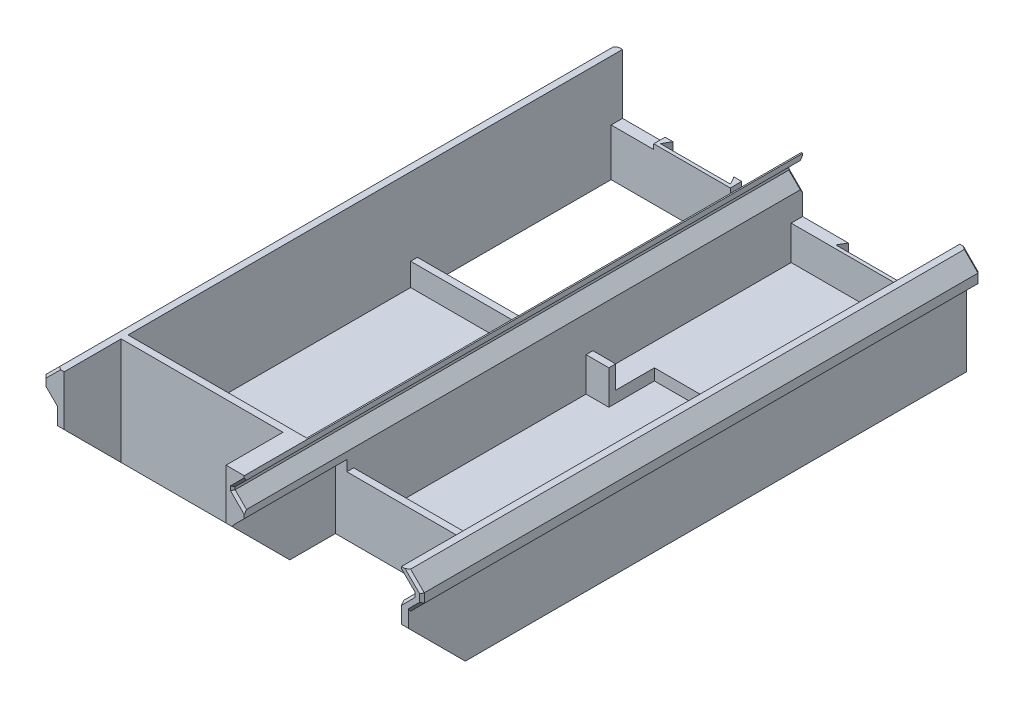
from build123d import *

# Parameters (mm, degrees)
EXTRUDE_1_DEPTH       = 200
SKETCH_3_W            = 148
SKETCH_3_H            = 194
CUT_EXTRUDE_1_DEPTH   = 44
SKETCH_4_W            = 8
SKETCH_4_H            = 194
EXTRUDE_1_2_DEPTH     = 44
CUT_EXTRUDE_2_DEPTH   = 222.580685079
CUT_EXTRUDE_5_DEPTH   = 219.876677606
MOVE_FACE_1_BY        = 2
MOVE_FACE_1_2_BY      = 2
CUT_EXTRUDE_6_DEPTH   = 222.580685079
CUT_EXTRUDE_7_DEPTH   = 16.595837
MOVE_FACE_2_BY        = 45
MOVE_FACE_3_BY        = 20
SKETCH_13_W           = 71
SKETCH_13_H           = 47
CUT_EXTRUDE_8_DEPTH   = 25
SKETCH_14_W           = 69
SKETCH_14_H           = 26
CUT_EXTRUDE_9_DEPTH   = 45
CUT_EXTRUDE_10_DEPTH  = 45
CHAMFER_1_SIZE        = 25
CUT_EXTRUDE_11_REACH  = 222.964
SKETCH_16_W           = 71
SKETCH_16_H           = 85
SKETCH_17_W           = 71
SKETCH_17_H           = 3
EXTRUDE_2_DEPTH       = 10
SKETCH_18_W           = 18.7
SKETCH_18_H           = 5
CUT_EXTRUDE_12_DEPTH  = 2.2
SKETCH_19_W           = 69
SKETCH_19_H           = 90
EXTRUDE_3_DEPTH       = 15
SKETCH_20_W           = 56
SKETCH_20_H           = 87
CUT_EXTRUDE_13_DEPTH  = 10
CUT_EXTRUDE_14_REACH  = 220.472
SKETCH_21_W           = 36
SKETCH_21_H           = 34
SKETCH_22_W           = 2
SKETCH_22_H           = 17
SKETCH_22_H_2         = 35
CUT_EXTRUDE_1_2_DEPTH = 7
MOVE_FACE_4_BY        = 3
CHAMFER_2_SIZE        = 1


with BuildPart() as part:
    # 草图1 → Extrude 1 (new body)
    with BuildSketch(Plane.XY):
        Polygon((77, 0), (-77, 0), (-77, 31), (-83, 37), (-83, 41), (-77, 47), (77, 47), (83, 41), (83, 37), (77, 31), align=None)
    extrude(amount=-EXTRUDE_1_DEPTH)

    # 草图3 → Cut-Extrude 1 (cut)
    with BuildSketch(Plane(origin=(0, 47, 0), x_dir=(1, 0, 0), z_dir=(0, 1, 0))):
        with Locations((0, 100)):
            Rectangle(SKETCH_3_W, SKETCH_3_H)
    extrude(amount=-CUT_EXTRUDE_1_DEPTH, mode=Mode.SUBTRACT)

    # 草图4 → Extrude 1 2 (add)
    with BuildSketch(Plane(origin=(0, 3, 0), x_dir=(1, 0, 0), z_dir=(0, 1, 0))):
        with Locations((1, 100)):
            Rectangle(SKETCH_4_W, SKETCH_4_H)
    extrude(amount=EXTRUDE_1_2_DEPTH)

    # 草图5 → 切除-拉伸2 (cut, through all)
    with BuildSketch(Plane(origin=(0, 0, -200), x_dir=(-1, 0, 0), z_dir=(0, 0, -1))):
        Polygon((-74, 47), (-74, 44.767409819), (-79, 39.767409819), (-79, 38.656854249), (-74, 33.656854249), (-74, 26), (-5, 26), (-5, 33.656854249), (0, 38.656854249), (0, 39.767409819), (-5, 44.767409819), (-5, 47), align=None)
    extrude(amount=-CUT_EXTRUDE_2_DEPTH, mode=Mode.SUBTRACT)

    # 草图9 → 切除-拉伸5 (cut, through all)
    with BuildSketch(Plane(origin=(0, 0, -3), x_dir=(-1, 0, 0), z_dir=(0, 0, -1))):
        Polygon((-4.404163056, 47), (3, 39.595836944), (74, 39.595836944), (74, 47), (3, 47), align=None)
    extrude(amount=CUT_EXTRUDE_5_DEPTH, mode=Mode.SUBTRACT)

    # Move Face 1: a face moved outward by 2.0
    extrude(part.faces().sort_by_distance((39.5, 14.5, -197))[0], amount=MOVE_FACE_1_BY, dir=(0, 0, 1))

    # Move Face 1 2: a face moved outward by 2.0
    extrude(part.faces().sort_by_distance((-38.5, 21.297918472, -197))[0], amount=MOVE_FACE_1_2_BY, dir=(0, 0, 1))

    # 草图11 → 切除-拉伸6 (cut, through all)
    with BuildSketch(Plane.XZ):
        Polygon((51.883419246, -200), (53.904145188, -196.5), (23.095854812, -196.5), (25.116580754, -200), align=None)
        Polygon((-53.904145188, -196.5), (-23.095854812, -196.5), (-25.116580754, -200), (-51.883419246, -200), align=None)
    extrude(amount=-CUT_EXTRUDE_6_DEPTH, mode=Mode.SUBTRACT)

    # 草图12 → 切除-拉伸7 (cut)
    with BuildSketch(Plane(origin=(0, 39.595836944, 0), x_dir=(1, 0, 0), z_dir=(0, 1, 0))):
        Polygon((-53.904145188, 196.5), (-51.883419246, 200), (-74, 200), (-74, 195), (-3, 195), (-3, 200), (-25.116580754, 200), (-23.095854812, 196.5), align=None)
        Polygon((53.904145188, 196.5), (23.095854812, 196.5), (25.116580754, 200), (5, 200), (5, 195), (74, 195), (74, 200), (51.883419246, 200), align=None)
    extrude(amount=-CUT_EXTRUDE_7_DEPTH, mode=Mode.SUBTRACT)

    # Move Face 2: a face moved outward by 45.0
    extrude(part.faces().sort_by_distance((-10.200110487, 20.43272532, 0))[0], amount=MOVE_FACE_2_BY, dir=(0, 0, 1))

    # Move Face 3: a face moved inward by 20.0
    extrude(part.faces().sort_by_distance((-38.169755743, 25.169887896, -3))[0], amount=MOVE_FACE_3_BY, dir=(0, 0, 1), mode=Mode.SUBTRACT)

    # 草图13 → 切除-拉伸8 (cut)
    with BuildSketch(Plane.XY.offset(45)):
        with Locations((-38.5, 23.5)):
            Rectangle(SKETCH_13_W, SKETCH_13_H)
    extrude(amount=-CUT_EXTRUDE_8_DEPTH, mode=Mode.SUBTRACT)

    # 草图14 → 切除-拉伸9 (cut)
    with BuildSketch(Plane.XY.offset(45)):
        with Locations((39.5, 13)):
            Rectangle(SKETCH_14_W, SKETCH_14_H)
    extrude(amount=-CUT_EXTRUDE_9_DEPTH, mode=Mode.SUBTRACT)

    # 草图15 → 切除-拉伸10 (cut)
    with BuildSketch(Plane.XY.offset(45)):
        Polygon((5, 0), (0, 0), (0, 25.656854249), (5, 30.656854249), align=None)
    extrude(amount=-CUT_EXTRUDE_10_DEPTH, mode=Mode.SUBTRACT)

    # 倒角1
    chamfer_1_edges = [part.edges().sort_by_distance(p)[0] for p in [
        (75.5, 0, 45),
        (-1.5, 0, 45),
        (-75.5, 0, 45),
    ]]
    chamfer(chamfer_1_edges, length=CHAMFER_1_SIZE)

    # 草图16 → 切除-拉伸11 (cut, up to next)
    with BuildSketch(Plane(origin=(0, 3, 0), x_dir=(1, 0, 0), z_dir=(0, 1, 0)), mode=Mode.PRIVATE) as cut_extrude_11_sk1:
        with Locations((-38.5, 152.5)):
            Rectangle(SKETCH_16_W, SKETCH_16_H)
    cut_extrude_11_tool1 = extrude(cut_extrude_11_sk1.sketch, amount=-CUT_EXTRUDE_11_REACH, mode=Mode.PRIVATE) & part.part
    add(cut_extrude_11_tool1.solids().sort_by_distance((-38.5, 3, -152.5))[0], mode=Mode.SUBTRACT)

    # 草图17 → 凸台-拉伸2 (add)
    with BuildSketch(Plane(origin=(0, 3, 0), x_dir=(1, 0, 0), z_dir=(0, 1, 0))):
        with Locations((-38.5, 108.5)):
            Rectangle(SKETCH_17_W, SKETCH_17_H)
    extrude(amount=EXTRUDE_2_DEPTH)

    # 草图18 → 切除-拉伸12 (cut)
    with BuildSketch(Plane(origin=(0, 23, 0), x_dir=(1, 0, 0), z_dir=(0, 1, 0))):
        with Locations((-12.35, 197.5)):
            Rectangle(SKETCH_18_W, SKETCH_18_H)
        with Locations((-64.65, 197.5)):
            Rectangle(SKETCH_18_W, SKETCH_18_H)
    extrude(amount=-CUT_EXTRUDE_12_DEPTH, mode=Mode.SUBTRACT)

    # 草图19 → 凸台-拉伸3 (add)
    with BuildSketch(Plane(origin=(0, 3, 0), x_dir=(1, 0, 0), z_dir=(0, 1, 0))):
        with Locations((39.5, 150)):
            Rectangle(SKETCH_19_W, SKETCH_19_H)
    extrude(amount=EXTRUDE_3_DEPTH)

    # 草图20 → 切除-拉伸13 (cut)
    with BuildSketch(Plane(origin=(0, 18, 0), x_dir=(1, 0, 0), z_dir=(0, 1, 0))):
        with Locations((33, 151.5)):
            Rectangle(SKETCH_20_W, SKETCH_20_H)
    extrude(amount=-CUT_EXTRUDE_13_DEPTH, mode=Mode.SUBTRACT)

    # 切除-拉伸14: up to this face of the body (flat: up to its plane)
    cut_extrude_14_end = Plane(part.part.faces().sort_by_distance((39.5, 3, -54))[0])
    # 草图21 → 切除-拉伸14 (cut, up to the picked face)
    with BuildSketch(Plane(origin=(0, 18, 0), x_dir=(1, 0, 0), z_dir=(0, 1, 0)), mode=Mode.PRIVATE) as cut_extrude_14_sk1:
        with Locations((33, 108)):
            Rectangle(SKETCH_21_W, SKETCH_21_H)
    cut_extrude_14_tool1 = split(extrude(cut_extrude_14_sk1.sketch, amount=-CUT_EXTRUDE_14_REACH, mode=Mode.PRIVATE), bisect_by=cut_extrude_14_end, keep=Keep.BOTH, mode=Mode.PRIVATE)
    add(cut_extrude_14_tool1.solids().sort_by(Axis((33, 18, -108), (0, -1, 0)))[0], mode=Mode.SUBTRACT)

    # 草图22 → Cut-Extrude 1 2 (cut)
    with BuildSketch(Plane(origin=(0, 18, 0), x_dir=(1, 0, 0), z_dir=(0, 1, 0))):
        with Locations((66, 181.5)):
            Rectangle(SKETCH_22_W, SKETCH_22_H)
        with Locations((66, 158.5)):
            Rectangle(SKETCH_22_W, SKETCH_22_H)
        with Locations((66, 126.5)):
            Rectangle(SKETCH_22_W, SKETCH_22_H_2)
    extrude(amount=-CUT_EXTRUDE_1_2_DEPTH, mode=Mode.SUBTRACT)

    # Move Face 4: a face moved outward by 3.0
    extrude(part.faces().sort_by_distance((66, 11, -126.5))[0], amount=MOVE_FACE_4_BY, dir=(0, 1, 0))

    # 倒角2
    chamfer_2_edges = [part.edges().sort_by_distance(p)[0] for p in [
        (-80, 34, 45),
        (-83, 39, 45),
        (-80, 44, 45),
        (80, 44, 45),
        (83, 39, 45),
        (80, 34, 45),
        (80, 34, -200),
        (83, 39, -200),
        (80, 44, -200),
        (-80, 44, -200),
        (-83, 39, -200),
        (-80, 34, -200),
        (2.5, 42.267409819, 45),
        (0, 39.212132034, 45),
        (2.5, 36.156854249, 45),
        (76.5, 36.156854249, 45),
        (79, 39.212132034, 45),
        (76.5, 42.267409819, 45),
        (76.5, 42.267409819, -200),
        (76.5, 36.156854249, -200),
        (2.5, 36.156854249, -200),
        (0, 39.212132034, -200),
        (2.5, 42.267409819, -200),
    ]]
    chamfer(chamfer_2_edges, length=CHAMFER_2_SIZE)


solid = part.part
